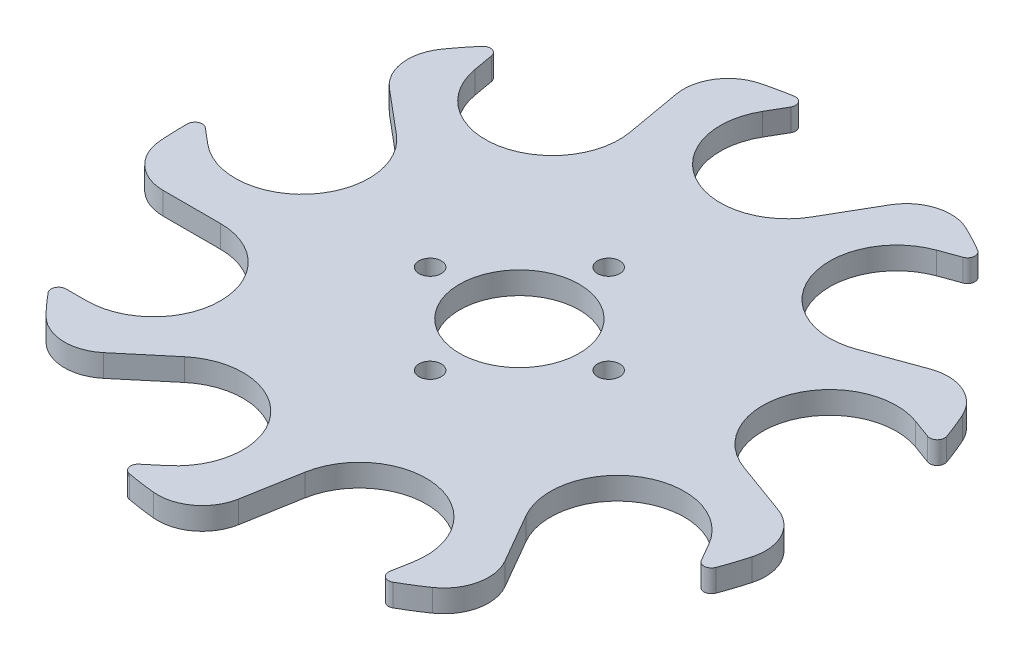
from build123d import *

# Parameters (mm, degrees)
SKETCH_1_R      = 8.05
SKETCH_1_R_2    = 1.5
EXTRUDE_1_DEPTH = 3


with BuildPart() as part:
    # 草图1 → 凸台-拉伸1 (new body)
    with BuildSketch(Plane(origin=(0, 3, 0), x_dir=(1, 0, 0), z_dir=(0, 1, 0))):
        with BuildLine():
            Line((-38.88444419, -9), (-31.176914536, -9))
            ThreePointArc((-31.176914536, -9), (-22.176914536, -18), (-31.176914536, -27))
            Line((-31.176914536, -27), (-33.941125497, -27))
            ThreePointArc((-33.941125497, -27), (-34.845659531, -27.573598567), (-34.712514713, -28.636363636))
            ThreePointArc((-34.712514713, -28.636363636), (-33.459137261, -30.091296644), (-32.144826423, -31.491429536))
            ThreePointArc((-32.144826423, -31.491429536), (-28.151334956, -33.285439049), (-24.002123909, -31.888838923))
            Line((-24.002123909, -31.888838923), (-18.097813647, -26.93453436))
            ThreePointArc((-18.097813647, -26.93453436), (-5.418325172, -28.043845861), (-6.527636673, -40.723334336))
            Line((-6.527636673, -40.723334336), (-8.645145119, -42.500134892))
            ThreePointArc((-8.645145119, -42.500134892), (-8.969356337, -43.520960157), (-8.18422927, -44.249501593))
            ThreePointArc((-8.18422927, -44.249501593), (-6.288873528, -44.558389443), (-4.382064939, -44.786130742))
            ThreePointArc((-4.382064939, -44.786130742), (-0.169705906, -43.593454926), (2.111056904, -39.856535709))
            Line((2.111056904, -39.856535709), (3.449455383, -32.266100749))
            ThreePointArc((3.449455383, -32.266100749), (13.875558759, -24.965664571), (21.175994937, -35.391767947))
            Line((21.175994937, -35.391767947), (20.695994741, -38.113984332))
            ThreePointArc((20.695994741, -38.113984332), (21.10380837, -39.104380808), (22.173548005, -39.157805976))
            ThreePointArc((22.173548005, -39.157805976), (23.824024022, -38.17611661), (25.431113431, -37.124903632))
            ThreePointArc((25.431113431, -37.124903632), (27.891330424, -33.503608756), (27.236450729, -29.174916481))
            Line((27.236450729, -29.174916481), (23.382685902, -22.5))
            ThreePointArc((23.382685902, -22.5), (26.676914536, -10.205771366), (38.97114317, -13.5))
            Line((38.97114317, -13.5), (40.353248651, -15.893876913))
            ThreePointArc((40.353248651, -15.893876913), (41.302266598, -16.390427082), (42.156075737, -15.743737752))
            ThreePointArc((42.156075737, -15.743737752), (42.789395957, -13.930814535), (43.344791191, -12.092521515))
            ThreePointArc((43.344791191, -12.092521515), (42.901703271, -7.737051698), (39.617606559, -4.842029588))
            Line((39.617606559, -4.842029588), (32.374897819, -2.205899191))
            ThreePointArc((32.374897819, -2.205899191), (26.995845521, 9.329515686), (38.531260398, 14.708567983))
            Line((38.531260398, 14.708567983), (41.12876904, 13.763152154))
            ThreePointArc((41.12876904, 13.763152154), (42.174935261, 13.992789635), (42.41330712, 15.037000338))
            ThreePointArc((42.41330712, 15.037000338), (41.733133973, 16.832870485), (40.97695943, 18.598085813))
            ThreePointArc((40.97695943, 18.598085813), (37.837892358, 21.649757837), (33.461243979, 21.756496762))
            Line((33.461243979, 21.756496762), (26.218535239, 19.120366365))
            ThreePointArc((26.218535239, 19.120366365), (14.683120362, 24.499418662), (20.062172659, 36.034833539))
            Line((20.062172659, 36.034833539), (22.659681301, 36.980249368))
            ThreePointArc((22.659681301, 36.980249368), (23.313482993, 37.828624569), (22.824880729, 38.781758852))
            ThreePointArc((22.824880729, 38.781758852), (21.149474791, 39.720268328), (19.435552943, 40.586442093))
            ThreePointArc((19.435552943, 40.586442093), (15.06931109, 40.906405071), (11.647993461, 38.174916481))
            Line((11.647993461, 38.174916481), (7.794228634, 31.5))
            ThreePointArc((7.794228634, 31.5), (-4.5, 28.205771366), (-7.794228634, 40.5))
            Line((-7.794228634, 40.5), (-6.412123154, 42.893876913))
            ThreePointArc((-6.412123154, 42.893876913), (-6.456607068, 43.964025649), (-7.443561025, 44.380101389))
            ThreePointArc((-7.443561025, 44.380101389), (-9.330258696, 44.022111179), (-11.199964768, 43.583951051))
            ThreePointArc((-11.199964768, 43.583951051), (-14.750368314, 41.022490747), (-15.61548265, 36.730868511))
            Line((-15.61548265, 36.730868511), (-14.277084172, 29.140433551))
            ThreePointArc((-14.277084172, 29.140433551), (-21.57752035, 18.714330175), (-32.003623726, 26.014766353))
            Line((-32.003623726, 26.014766353), (-32.483623922, 28.736982738))
            ThreePointArc((-32.483623922, 28.736982738), (-33.205578925, 29.528170522), (-34.229077849, 29.212501255))
            ThreePointArc((-34.229077849, 29.212501255), (-35.444260445, 27.725518958), (-36.59489449, 26.18804493))
            ThreePointArc((-36.59489449, 26.18804493), (-37.668186452, 21.943697089), (-35.572300883, 18.100038947))
            Line((-35.572300883, 18.100038947), (-29.667990621, 13.145734384))
            ThreePointArc((-29.667990621, 13.145734384), (-28.55867912, 0.466245909), (-41.238167596, -0.643065592))
            Line((-41.238167596, -0.643065592), (-43.355676042, 1.133734964))
            ThreePointArc((-43.355676042, 1.133734964), (-44.417291364, 1.275756238), (-44.998428734, 0.376047124))
            ThreePointArc((-44.998428734, 0.376047124), (-44.973498813, -1.544151718), (-44.866666374, -3.461538462))
            ThreePointArc((-44.866666374, -3.461538462), (-42.960641513, -7.402796314), (-38.88444419, -9))
        make_face()
        with Locations(Location((0, 0, 0), (0, 0, 90))):
            Circle(SKETCH_1_R, mode=Mode.SUBTRACT)
        with Locations(Location((0, 12, 0), (0, 0, 270))):
            Circle(SKETCH_1_R_2, mode=Mode.SUBTRACT)
        with Locations(Location((12, 0, 0), (0, 0, 270))):
            Circle(SKETCH_1_R_2, mode=Mode.SUBTRACT)
        with Locations(Location((0, -12, 0), (0, 0, 270))):
            Circle(SKETCH_1_R_2, mode=Mode.SUBTRACT)
        with Locations(Location((-12, 0, 0), (0, 0, 270))):
            Circle(SKETCH_1_R_2, mode=Mode.SUBTRACT)
    extrude(amount=-EXTRUDE_1_DEPTH)


solid = part.part
